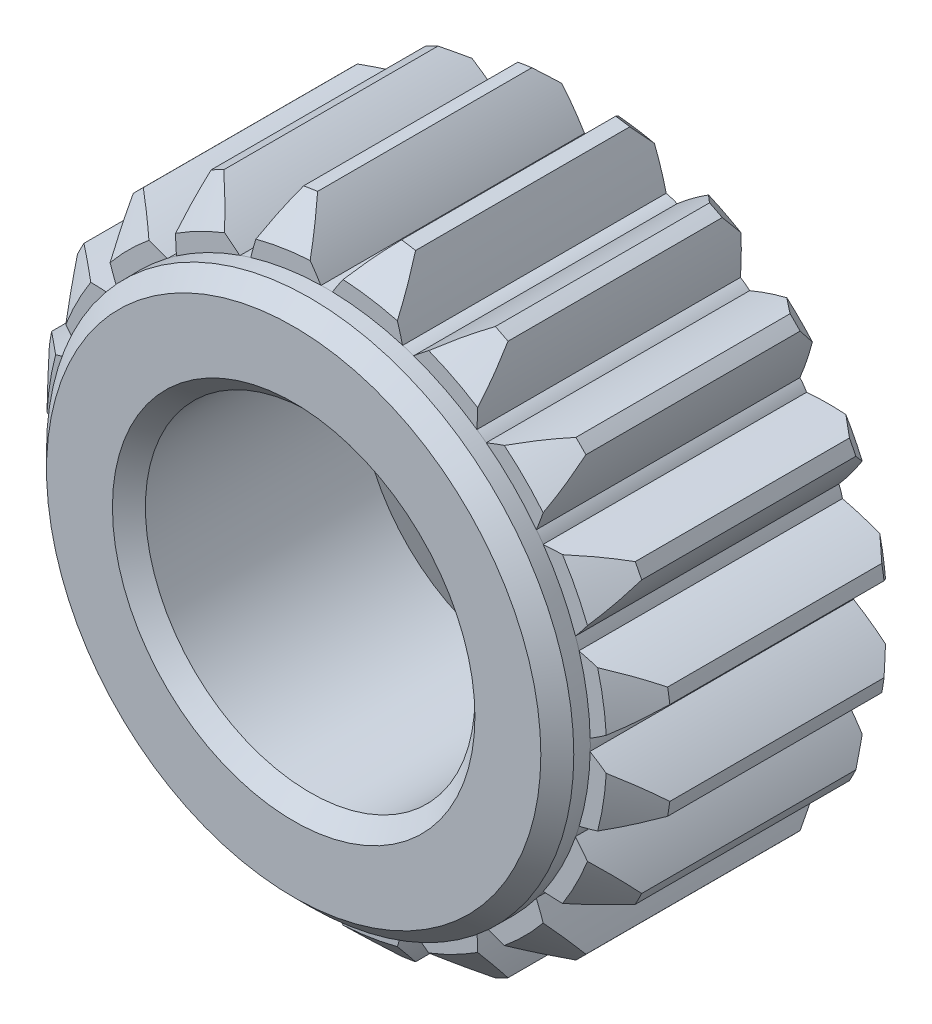
from build123d import *

# Parameters (mm, degrees)
SKETCH1_R           = 9.5
BOSS_EXTRUDE1_DEPTH = 4
FRONT_CHAMFER_SIZE  = 1
REAR_CHAMFER_SIZE   = 0.5
CUT_EXTRUDE1_DEPTH  = 16.636495771
CIRPATTERN1_COUNT   = 20
SKETCH3_R           = 8
BOSS_EXTRUDE2_DEPTH = 1
CHAMFER3_SIZE       = 0.5
SKETCH4_R           = 5
CUT_EXTRUDE2_DEPTH  = 5
SKETCH5_R           = 5
CUT_EXTRUDE3_DEPTH  = 15.221800659
CHAMFER4_SIZE       = 0.5
CHAMFER5_SIZE       = 2


with BuildPart() as part:
    # Sketch1 → Boss-Extrude1 (new, symmetric)
    with BuildSketch(Plane.XY):
        Circle(SKETCH1_R)
    extrude(amount=BOSS_EXTRUDE1_DEPTH, both=True)

    # Front Chamfer
    front_chamfer_edges = [part.edges().sort_by_distance(p)[0] for p in [
        (-9.5, 0, 4),
    ]]
    chamfer(front_chamfer_edges, length=FRONT_CHAMFER_SIZE)

    # Rear Chamfer
    rear_chamfer_edges = [part.edges().sort_by_distance(p)[0] for p in [
        (-9.5, 0, -4),
    ]]
    chamfer(rear_chamfer_edges, length=REAR_CHAMFER_SIZE)

    # Sketch2 → Cut-Extrude1 (cut, through all)
    with BuildSketch(Plane.XY.offset(4)):
        with BuildLine():
            ThreePointArc((-1.272868761, 9.414340397), (0, 9.5), (1.272868761, 9.414340397))
            ThreePointArc((1.272868761, 9.414340397), (0.683437035, 8.733062513), (0.174338803, 7.989834213))
            ThreePointArc((0.174338803, 7.989834213), (0, 8), (-0.174338803, 7.989834213))
            ThreePointArc((-0.174338803, 7.989834213), (-0.683437035, 8.733062513), (-1.272868761, 9.414340397))
        make_face()
    cut_extrude1 = extrude(amount=-CUT_EXTRUDE1_DEPTH, mode=Mode.SUBTRACT)

    # CirPattern1: Cut-Extrude1 ×20 about axis
    cirpattern1_axis = Axis((0, 0, 0), (0, 0, 1))
    for i in range(1, CIRPATTERN1_COUNT):
        add(cut_extrude1.rotate(cirpattern1_axis, i * 360 / CIRPATTERN1_COUNT), mode=Mode.SUBTRACT)

    # Sketch3 → Boss-Extrude2 (add)
    with BuildSketch(Plane.XY.offset(4)):
        Circle(SKETCH3_R)
    extrude(amount=BOSS_EXTRUDE2_DEPTH)

    # Chamfer3
    chamfer3_edges = [part.edges().sort_by_distance(p)[0] for p in [
        (-8, 0, 5),
    ]]
    chamfer(chamfer3_edges, length=CHAMFER3_SIZE)

    # Sketch4 → Cut-Extrude2 (cut)
    with BuildSketch(Plane.XY.offset(5)):
        Circle(SKETCH4_R)
    extrude(amount=-CUT_EXTRUDE2_DEPTH, mode=Mode.SUBTRACT)

    # Sketch5 → Cut-Extrude3 (cut, through all)
    with BuildSketch(Plane.XY):
        Circle(SKETCH5_R)
    extrude(amount=-CUT_EXTRUDE3_DEPTH, mode=Mode.SUBTRACT)

    # Chamfer4
    chamfer4_edges = [part.edges().sort_by_distance(p)[0] for p in [
        (-5, 0, 5),
    ]]
    chamfer(chamfer4_edges, length=CHAMFER4_SIZE)

    # Chamfer5
    chamfer5_edges = [part.edges().sort_by_distance(p)[0] for p in [
        (-5, 0, -4),
    ]]
    chamfer(chamfer5_edges, length=CHAMFER5_SIZE)


solid = part.part
